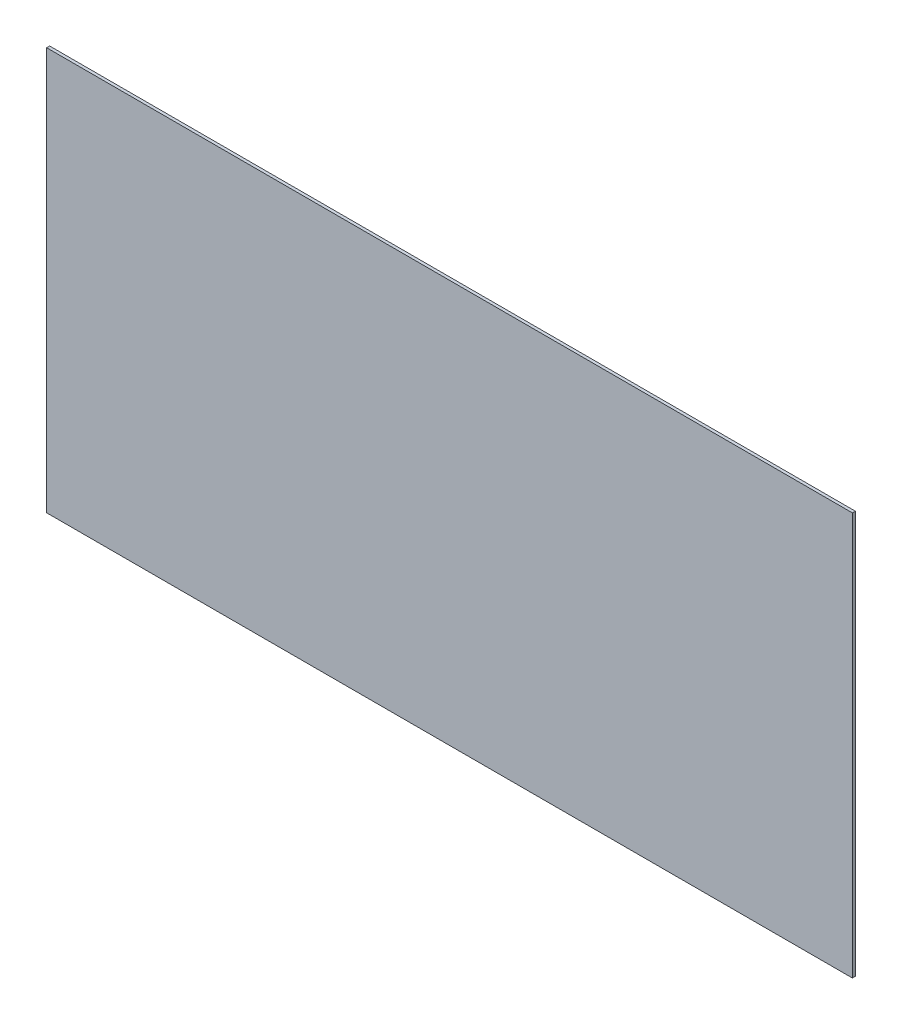
from build123d import *

# Parameters (mm, degrees)
SKETCH1_W           = 20
SKETCH1_H           = 10
BOSS_EXTRUDE1_DEPTH = 0.07366


with BuildPart() as part:
    # Sketch1 → Boss-Extrude1 (new body)
    with BuildSketch(Plane.XY):
        with Locations((39, 0)):
            Rectangle(SKETCH1_W, SKETCH1_H)
    extrude(amount=BOSS_EXTRUDE1_DEPTH)


solid = part.part
